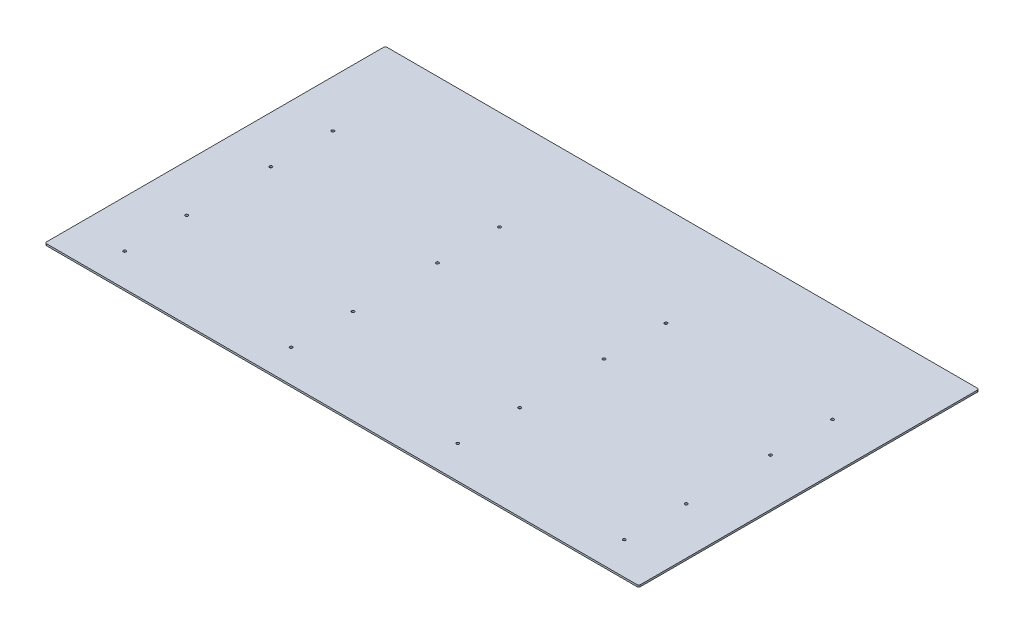
from build123d import *

# Parameters (mm, degrees)
BOSS_EXTRUDE1_DEPTH          = 3.175
F_10_0_1935_DIAMETER_HOLE1_D = 4.9149


with BuildPart() as part:
    # Sketch1 → Boss-Extrude1 (new body)
    with BuildSketch(Plane(origin=(0, 0, 0), x_dir=(1, 0, 0), z_dir=(0, 1, 0))):
        with BuildLine():
            Line((-517.525, -298.45), (517.525, -298.45))
            ThreePointArc((517.525, -298.45), (519.77006403, -297.52006403), (520.7, -295.275))
            Line((520.7, -295.275), (520.7, 295.275))
            ThreePointArc((520.7, 295.275), (519.77006403, 297.52006403), (517.525, 298.45))
            Line((517.525, 298.45), (-517.525, 298.45))
            ThreePointArc((-517.525, 298.45), (-519.77006403, 297.52006403), (-520.7, 295.275))
            Line((-520.7, 295.275), (-520.7, -295.275))
            ThreePointArc((-520.7, -295.275), (-519.77006403, -297.52006403), (-517.525, -298.45))
        make_face()
    extrude(amount=BOSS_EXTRUDE1_DEPTH)

    # #10 (0.1935) Diameter Hole1 (through all)
    with Locations(Plane(origin=(-438.15, 0, 241.245275247), x_dir=(0, 0, -1), z_dir=(0, -1, 0))):
        with Locations((0, 0), (108.712, 0), (0, 292.1), (108.712, 292.1), (0, 584.2), (108.712, 584.2), (0, 876.3), (108.712, 876.3), (256.539999992, 876.3), (365.251999992, 876.3), (256.539999992, 584.2), (365.251999992, 584.2), (365.251999992, 292.1), (256.539999992, 292.1), (256.539999992, 0), (365.251999992, 0)):
            Hole(F_10_0_1935_DIAMETER_HOLE1_D / 2)


solid = part.part
